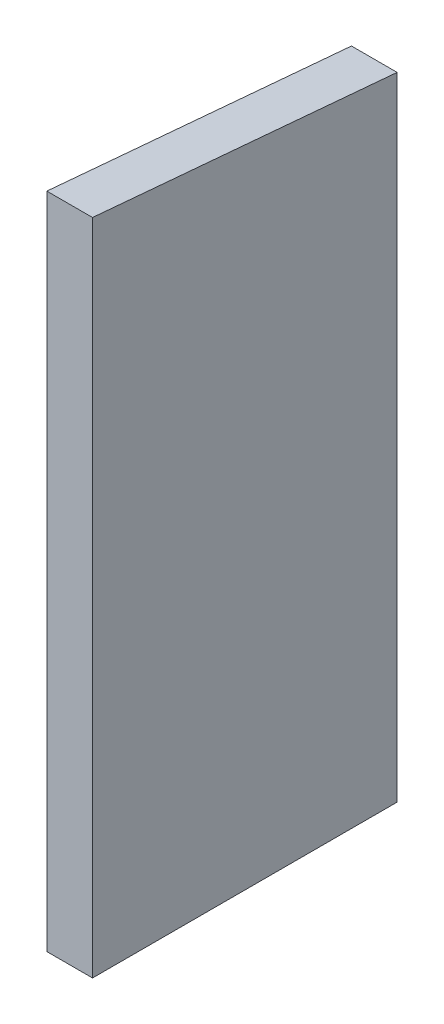
from build123d import *

# Parameters (mm, degrees)
CROQUIS1_W              = 15
CROQUIS1_H              = 100
SALIENTE_EXTRUIR1_DEPTH = 250
CORTAR_EXTRUIR1_DEPTH   = 256.391855782


with BuildPart() as part:
    # Croquis1 → Saliente-Extruir1 (new body)
    with BuildSketch(Plane(origin=(0, 0, 0), x_dir=(1, 0, 0), z_dir=(0, 1, 0))):
        Rectangle(CROQUIS1_W, CROQUIS1_H)
    extrude(amount=SALIENTE_EXTRUIR1_DEPTH)

    # Croquis2 → Cortar-Extruir1 (cut, through all)
    with BuildSketch(Plane(origin=(7.5, 0, 0), x_dir=(0, 0, -1), z_dir=(1, 0, 0))):
        Polygon((-50, 216.202330913), (50, 207.45346456), (50, 250), (-50, 250), align=None)
    extrude(amount=-CORTAR_EXTRUIR1_DEPTH, mode=Mode.SUBTRACT)


solid = part.part
